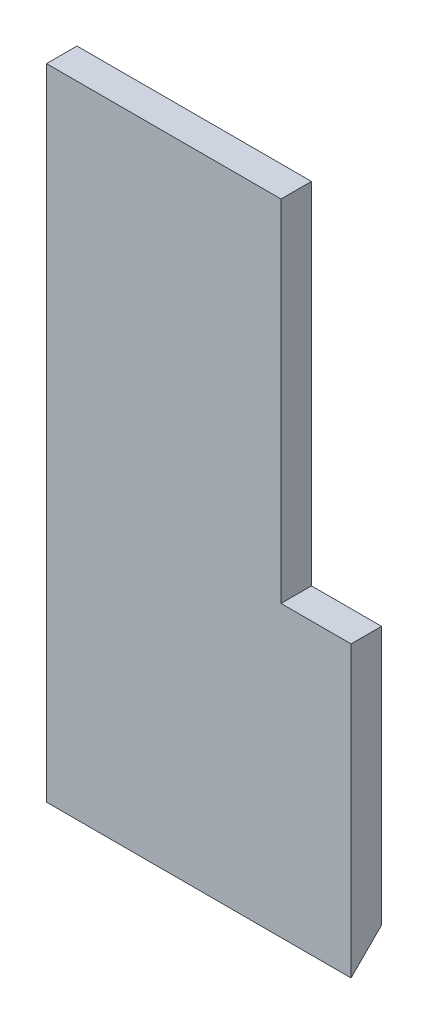
from build123d import *

# Parameters (mm, degrees)
BOSS_EXTRU_1_DEPTH      = 10
ENL_V_MAT_EXTRU_1_DEPTH = 100


with BuildPart() as part:
    # Esquisse1 → Boss.-Extru.1 (new body)
    with BuildSketch(Plane.XY):
        Polygon((-50, -105), (50, -105), (50, -10), (27, -10), (27, 105), (-50, 105), align=None)
    extrude(amount=BOSS_EXTRU_1_DEPTH)

    # Esquisse7 → Enlèv. mat.-Extru.1 (cut)
    with BuildSketch(Plane(origin=(50, 0, 0), x_dir=(0, 0, -1), z_dir=(1, 0, 0))):
        Polygon((-10, -105), (0, -105), (0, -95), align=None)
    extrude(amount=-ENL_V_MAT_EXTRU_1_DEPTH, mode=Mode.SUBTRACT)


solid = part.part
